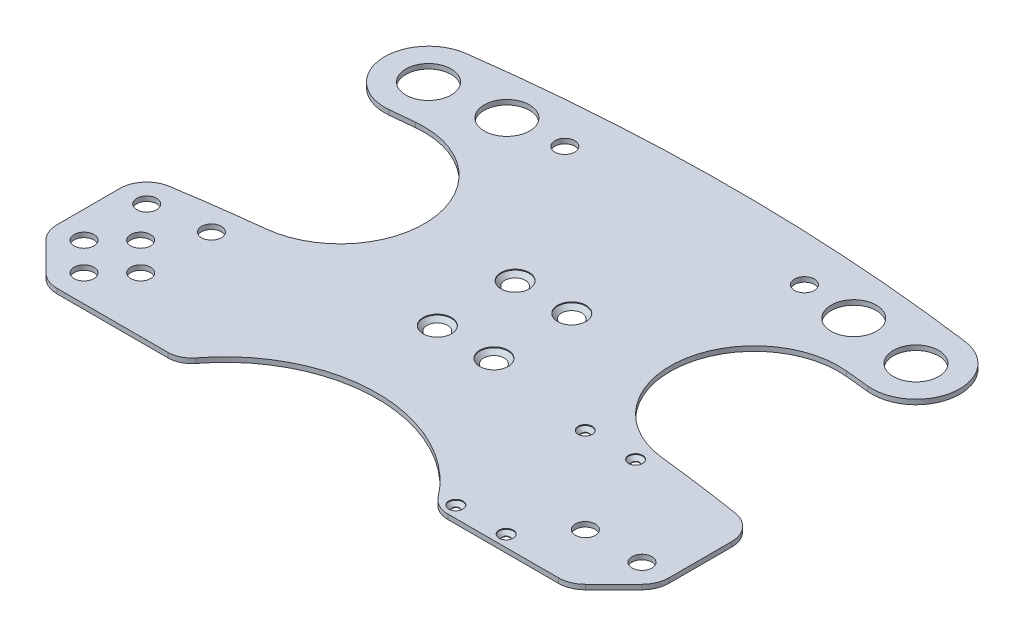
from build123d import *

# Parameters (mm, degrees)
SKETCH1_R                                      = 2.5
BOSS_EXTRUDE1_DEPTH                            = 1.7
CUT_EXTRUDE1_REACH                             = 155.062
SKETCH2_R                                      = 3.5
SKETCH2_R_2                                    = 8
CUT_EXTRUDE2_REACH                             = 155.062
SKETCH3_R                                      = 1.3
CSK_FOR_M5_FLAT_HEAD_MACHINE_SCREW1_AT_2_COUNT = 2
CSK_FOR_M5_FLAT_HEAD_MACHINE_SCREW1_AT_2_PITCH = 20
CSK_FOR_M5_FLAT_HEAD_MACHINE_SCREW1_AT_3_COUNT = 2
CSK_FOR_M5_FLAT_HEAD_MACHINE_SCREW1_AT_3_PITCH = 34.003676272
CSK_FOR_M5_FLAT_HEAD_MACHINE_SCREW1_AT_4_COUNT = 2
CSK_FOR_M5_FLAT_HEAD_MACHINE_SCREW1_AT_4_PITCH = 27.5
CSK_FOR_M2_5_FLAT_HEAD_MACHINE_SCREW1_AT_COUNT = 2
CSK_FOR_M2_5_FLAT_HEAD_MACHINE_SCREW1_AT_PITCH = 17.78
CSK_FOR_M2_5_FLAT_HEAD_MACHINE_SCREW_2_COUNT   = 2
CSK_FOR_M2_5_FLAT_HEAD_MACHINE_SCREW_2_PITCH   = 49.055548106
CSK_FOR_M2_5_FLAT_HEAD_MACHINE_SCREW_3_COUNT   = 2
CSK_FOR_M2_5_FLAT_HEAD_MACHINE_SCREW_3_PITCH   = 45.72
FILLET1_R                                      = 8.5


with BuildPart() as part:
    # Sketch1 → Boss-Extrude1 (new body)
    with BuildSketch(Plane(origin=(0, 0, 0), x_dir=(1, 0, 0), z_dir=(0, 1, 0))):
        with BuildLine():
            ThreePointArc((-73.314391493, 95), (-120, 0), (-73.314391493, -95))
            Line((-73.314391493, -95), (73.314391493, -95))
            ThreePointArc((73.314391493, -95), (120, 0), (73.314391493, 95))
            Line((73.314391493, 95), (-73.314391493, 95))
        make_face()
        with Locations(Location((10, 13.75, 0), (0, 0, 270))):
            Circle(SKETCH1_R, mode=Mode.SUBTRACT)
        with Locations(Location((10, -13.75, 0), (0, 0, 270))):
            Circle(SKETCH1_R, mode=Mode.SUBTRACT)
        with Locations(Location((-10, -13.75, 0), (0, 0, 270))):
            Circle(SKETCH1_R, mode=Mode.SUBTRACT)
        with Locations(Location((-10, 13.75, 0), (0, 0, 270))):
            Circle(SKETCH1_R, mode=Mode.SUBTRACT)
    extrude(amount=BOSS_EXTRUDE1_DEPTH)

    # Sketch2 → Cut-Extrude1 (cut, up to next)
    with BuildSketch(Plane(origin=(0, 1.7, 0), x_dir=(1, 0, 0), z_dir=(0, 1, 0)), mode=Mode.PRIVATE) as cut_extrude1_sk1:
        with Locations(Location((-88.540600769, -40, 0), (0, 0, 270))):
            Circle(SKETCH2_R)
    cut_extrude1_tool1 = extrude(cut_extrude1_sk1.sketch, amount=-CUT_EXTRUDE1_REACH, mode=Mode.PRIVATE) & part.part
    # Sketch2 → Cut-Extrude1 (cut, up to next)
    with BuildSketch(Plane(origin=(0, 1.7, 0), x_dir=(1, 0, 0), z_dir=(0, 1, 0)), mode=Mode.PRIVATE) as cut_extrude1_sk2:
        with Locations(Location((-78.540600769, -50, 0), (0, 0, 270))):
            Circle(SKETCH2_R)
    cut_extrude1_tool2 = extrude(cut_extrude1_sk2.sketch, amount=-CUT_EXTRUDE1_REACH, mode=Mode.PRIVATE) & part.part
    # Sketch2 → Cut-Extrude1 (cut, up to next)
    with BuildSketch(Plane(origin=(0, 1.7, 0), x_dir=(1, 0, 0), z_dir=(0, 1, 0)), mode=Mode.PRIVATE) as cut_extrude1_sk3:
        with Locations(Location((-88.540600769, -60, 0), (0, 0, 270))):
            Circle(SKETCH2_R)
    cut_extrude1_tool3 = extrude(cut_extrude1_sk3.sketch, amount=-CUT_EXTRUDE1_REACH, mode=Mode.PRIVATE) & part.part
    # Sketch2 → Cut-Extrude1 (cut, up to next)
    with BuildSketch(Plane(origin=(0, 1.7, 0), x_dir=(1, 0, 0), z_dir=(0, 1, 0)), mode=Mode.PRIVATE) as cut_extrude1_sk4:
        with Locations(Location((-98.540600769, -50, 0), (0, 0, 270))):
            Circle(SKETCH2_R)
    cut_extrude1_tool4 = extrude(cut_extrude1_sk4.sketch, amount=-CUT_EXTRUDE1_REACH, mode=Mode.PRIVATE) & part.part
    # Sketch2 → Cut-Extrude1 (cut, up to next)
    with BuildSketch(Plane(origin=(0, 1.7, 0), x_dir=(1, 0, 0), z_dir=(0, 1, 0)), mode=Mode.PRIVATE) as cut_extrude1_sk5:
        with Locations(Location((78.540600769, -50, 0), (0, 0, 270))):
            Circle(SKETCH2_R)
    cut_extrude1_tool5 = extrude(cut_extrude1_sk5.sketch, amount=-CUT_EXTRUDE1_REACH, mode=Mode.PRIVATE) & part.part
    # Sketch2 → Cut-Extrude1 (cut, up to next)
    with BuildSketch(Plane(origin=(0, 1.7, 0), x_dir=(1, 0, 0), z_dir=(0, 1, 0)), mode=Mode.PRIVATE) as cut_extrude1_sk6:
        with Locations(Location((98.540600769, -50, 0), (0, 0, 270))):
            Circle(SKETCH2_R)
    cut_extrude1_tool6 = extrude(cut_extrude1_sk6.sketch, amount=-CUT_EXTRUDE1_REACH, mode=Mode.PRIVATE) & part.part
    # Sketch2 → Cut-Extrude1 (cut, up to next)
    with BuildSketch(Plane(origin=(0, 1.7, 0), x_dir=(1, 0, 0), z_dir=(0, 1, 0)), mode=Mode.PRIVATE) as cut_extrude1_sk7:
        with Locations(Location((-98.540600769, -27.862546721, 0), (0, 0, 270))):
            Circle(SKETCH2_R)
    cut_extrude1_tool7 = extrude(cut_extrude1_sk7.sketch, amount=-CUT_EXTRUDE1_REACH, mode=Mode.PRIVATE) & part.part
    # Sketch2 → Cut-Extrude1 (cut, up to next)
    with BuildSketch(Plane(origin=(0, 1.7, 0), x_dir=(1, 0, 0), z_dir=(0, 1, 0)), mode=Mode.PRIVATE) as cut_extrude1_sk8:
        with Locations(Location((-78.540600769, -25, 0), (0, 0, 270))):
            Circle(SKETCH2_R)
    cut_extrude1_tool8 = extrude(cut_extrude1_sk8.sketch, amount=-CUT_EXTRUDE1_REACH, mode=Mode.PRIVATE) & part.part
    # Sketch2 → Cut-Extrude1 (cut, up to next)
    with BuildSketch(Plane(origin=(0, 1.7, 0), x_dir=(1, 0, 0), z_dir=(0, 1, 0)), mode=Mode.PRIVATE) as cut_extrude1_sk9:
        with Locations(Location((-86.094520408, 59.228232759, 0), (0, 0, 270))):
            Circle(SKETCH2_R_2)
    cut_extrude1_tool9 = extrude(cut_extrude1_sk9.sketch, amount=-CUT_EXTRUDE1_REACH, mode=Mode.PRIVATE) & part.part
    # Sketch2 → Cut-Extrude1 (cut, up to next)
    with BuildSketch(Plane(origin=(0, 1.7, 0), x_dir=(1, 0, 0), z_dir=(0, 1, 0)), mode=Mode.PRIVATE) as cut_extrude1_sk10:
        with Locations(Location((-61.259580586, 62.084312054, 0), (0, 0, 270))):
            Circle(SKETCH2_R_2)
    cut_extrude1_tool10 = extrude(cut_extrude1_sk10.sketch, amount=-CUT_EXTRUDE1_REACH, mode=Mode.PRIVATE) & part.part
    # Sketch2 → Cut-Extrude1 (cut, up to next)
    with BuildSketch(Plane(origin=(0, 1.7, 0), x_dir=(1, 0, 0), z_dir=(0, 1, 0)), mode=Mode.PRIVATE) as cut_extrude1_sk11:
        with Locations(Location((61.259580586, 62.084312054, 0), (0, 0, 270))):
            Circle(SKETCH2_R_2)
    cut_extrude1_tool11 = extrude(cut_extrude1_sk11.sketch, amount=-CUT_EXTRUDE1_REACH, mode=Mode.PRIVATE) & part.part
    # Sketch2 → Cut-Extrude1 (cut, up to next)
    with BuildSketch(Plane(origin=(0, 1.7, 0), x_dir=(1, 0, 0), z_dir=(0, 1, 0)), mode=Mode.PRIVATE) as cut_extrude1_sk12:
        with Locations(Location((86.094520408, 59.228232759, 0), (0, 0, 270))):
            Circle(SKETCH2_R_2)
    cut_extrude1_tool12 = extrude(cut_extrude1_sk12.sketch, amount=-CUT_EXTRUDE1_REACH, mode=Mode.PRIVATE) & part.part
    # Sketch2 → Cut-Extrude1 (cut, up to next)
    with BuildSketch(Plane(origin=(0, 1.7, 0), x_dir=(1, 0, 0), z_dir=(0, 1, 0)), mode=Mode.PRIVATE) as cut_extrude1_sk13:
        with Locations(Location((-42.320942156, 63.610082158, 0), (0, 0, 270))):
            Circle(SKETCH2_R)
    cut_extrude1_tool13 = extrude(cut_extrude1_sk13.sketch, amount=-CUT_EXTRUDE1_REACH, mode=Mode.PRIVATE) & part.part
    # Sketch2 → Cut-Extrude1 (cut, up to next)
    with BuildSketch(Plane(origin=(0, 1.7, 0), x_dir=(1, 0, 0), z_dir=(0, 1, 0)), mode=Mode.PRIVATE) as cut_extrude1_sk14:
        with Locations(Location((42.320942156, 63.610082158, 0), (0, 0, 270))):
            Circle(SKETCH2_R)
    cut_extrude1_tool14 = extrude(cut_extrude1_sk14.sketch, amount=-CUT_EXTRUDE1_REACH, mode=Mode.PRIVATE) & part.part
    add(cut_extrude1_tool1.solids().sort_by_distance((-88.540601, 1.7, 40))[0], mode=Mode.SUBTRACT)
    add(cut_extrude1_tool2.solids().sort_by_distance((-78.540601, 1.7, 50))[0], mode=Mode.SUBTRACT)
    add(cut_extrude1_tool3.solids().sort_by_distance((-88.540601, 1.7, 60))[0], mode=Mode.SUBTRACT)
    add(cut_extrude1_tool4.solids().sort_by_distance((-98.540601, 1.7, 50))[0], mode=Mode.SUBTRACT)
    add(cut_extrude1_tool5.solids().sort_by_distance((78.540601, 1.7, 50))[0], mode=Mode.SUBTRACT)
    add(cut_extrude1_tool6.solids().sort_by_distance((98.540601, 1.7, 50))[0], mode=Mode.SUBTRACT)
    add(cut_extrude1_tool7.solids().sort_by_distance((-98.540601, 1.7, 27.862547))[0], mode=Mode.SUBTRACT)
    add(cut_extrude1_tool8.solids().sort_by_distance((-78.540601, 1.7, 25))[0], mode=Mode.SUBTRACT)
    add(cut_extrude1_tool9.solids().sort_by_distance((-86.09452, 1.7, -59.228233))[0], mode=Mode.SUBTRACT)
    add(cut_extrude1_tool10.solids().sort_by_distance((-61.259581, 1.7, -62.084312))[0], mode=Mode.SUBTRACT)
    add(cut_extrude1_tool11.solids().sort_by_distance((61.259581, 1.7, -62.084312))[0], mode=Mode.SUBTRACT)
    add(cut_extrude1_tool12.solids().sort_by_distance((86.09452, 1.7, -59.228233))[0], mode=Mode.SUBTRACT)
    add(cut_extrude1_tool13.solids().sort_by_distance((-42.320942, 1.7, -63.610082))[0], mode=Mode.SUBTRACT)
    add(cut_extrude1_tool14.solids().sort_by_distance((42.320942, 1.7, -63.610082))[0], mode=Mode.SUBTRACT)

    # Sketch3 → Cut-Extrude2 (cut, up to next)
    with BuildSketch(Plane(origin=(0, 1.7, 0), x_dir=(1, 0, 0), z_dir=(0, 1, 0)), mode=Mode.PRIVATE) as cut_extrude2_sk1:
        with BuildLine():
            Line((-76.105925997, 44.650651574), (-84.550645906, 43.805313077))
            ThreePointArc((-84.550645906, 43.805313077), (-99.436668425, 51.339184255), (-98.864520937, 68.01328179))
            ThreePointArc((-98.864520937, 68.01328179), (-119.734623718, 7.976207306), (-107.01241698, -54.298642821))
            ThreePointArc((-107.01241698, -54.298642821), (-107.779979915, -52.209948642), (-108.040600769, -50))
            Line((-108.040600769, -50), (-108.040600769, -27.862546721))
            ThreePointArc((-108.040600769, -27.862546721), (-105.768300058, -21.697292226), (-100.038419088, -18.48136661))
            ThreePointArc((-100.038419088, -18.48136661), (-84.982869082, -16.262381048), (-69.878431955, -14.405108328))
            ThreePointArc((-69.878431955, -14.405108328), (-43.620166463, 18.220082253), (-76.105925997, 44.650651574))
        make_face()
    cut_extrude2_tool1 = extrude(cut_extrude2_sk1.sketch, amount=-CUT_EXTRUDE2_REACH, mode=Mode.PRIVATE) & part.part
    # Sketch3 → Cut-Extrude2 (cut, up to next)
    with BuildSketch(Plane(origin=(0, 1.7, 0), x_dir=(1, 0, 0), z_dir=(0, 1, 0)), mode=Mode.PRIVATE) as cut_extrude2_sk2:
        with BuildLine():
            ThreePointArc((-98.864520937, 68.01328179), (-94.209951098, 72.433905203), (-88.163447862, 74.589532807))
            ThreePointArc((-88.163447862, 74.589532807), (1.3e-08, 80.5), (88.163447888, 74.589532804))
            ThreePointArc((88.163447888, 74.589532804), (94.209951109, 72.433905197), (98.864520937, 68.01328179))
            ThreePointArc((98.864520937, 68.01328179), (87.140491227, 82.501725974), (73.314391493, 95))
            Line((73.314391493, 95), (-73.314391493, 95))
            ThreePointArc((-73.314391493, 95), (-87.140491227, 82.501725974), (-98.864520937, 68.01328179))
        make_face()
    cut_extrude2_tool2 = extrude(cut_extrude2_sk2.sketch, amount=-CUT_EXTRUDE2_REACH, mode=Mode.PRIVATE) & part.part
    # Sketch3 → Cut-Extrude2 (cut, up to next)
    with BuildSketch(Plane(origin=(0, 1.7, 0), x_dir=(1, 0, 0), z_dir=(0, 1, 0)), mode=Mode.PRIVATE) as cut_extrude2_sk3:
        with BuildLine():
            ThreePointArc((-105.258115191, -56.717514421), (-106.230963324, -55.577483643), (-107.01241698, -54.298642821))
            ThreePointArc((-107.01241698, -54.298642821), (-92.431539977, -76.52718744), (-73.314391493, -95))
            Line((-73.314391493, -95), (73.314391493, -95))
            ThreePointArc((73.314391493, -95), (92.431539785, -76.527187671), (107.012416708, -54.298643357))
            ThreePointArc((107.012416708, -54.298643357), (106.230963147, -55.577483886), (105.258115191, -56.717514421))
            Line((105.258115191, -56.717514421), (95.258115191, -66.717514421))
            ThreePointArc((95.258115191, -66.717514421), (92.176093377, -68.776855559), (88.540600769, -69.5))
            Line((88.540600769, -69.5), (45.040600769, -69.5))
            ThreePointArc((45.040600769, -69.5), (0, -45), (-45.040600769, -69.5))
            Line((-45.040600769, -69.5), (-88.540600769, -69.5))
            ThreePointArc((-88.540600769, -69.5), (-92.176093377, -68.776855559), (-95.258115191, -66.717514421))
            Line((-95.258115191, -66.717514421), (-105.258115191, -56.717514421))
        make_face()
    cut_extrude2_tool3 = extrude(cut_extrude2_sk3.sketch, amount=-CUT_EXTRUDE2_REACH, mode=Mode.PRIVATE) & part.part
    # Sketch3 → Cut-Extrude2 (cut, up to next)
    with BuildSketch(Plane(origin=(0, 1.7, 0), x_dir=(1, 0, 0), z_dir=(0, 1, 0)), mode=Mode.PRIVATE) as cut_extrude2_sk4:
        with BuildLine():
            ThreePointArc((76.105925997, 44.650651574), (43.620166505, 18.220082647), (69.878431166, -14.405108241))
            ThreePointArc((69.878431166, -14.405108241), (84.982868127, -16.262380919), (100.038417968, -18.481366431))
            ThreePointArc((100.038417968, -18.481366431), (105.768299691, -21.697291795), (108.040600769, -27.862546721))
            Line((108.040600769, -27.862546721), (108.040600769, -50))
            ThreePointArc((108.040600769, -50), (107.779979845, -52.209948935), (107.012416708, -54.298643357))
            ThreePointArc((107.012416708, -54.298643357), (119.734623738, 7.976207006), (98.864520937, 68.01328179))
            ThreePointArc((98.864520937, 68.01328179), (99.436668425, 51.339184255), (84.550645906, 43.805313077))
            Line((84.550645906, 43.805313077), (76.105925997, 44.650651574))
        make_face()
    cut_extrude2_tool4 = extrude(cut_extrude2_sk4.sketch, amount=-CUT_EXTRUDE2_REACH, mode=Mode.PRIVATE) & part.part
    # Sketch3 → Cut-Extrude2 (cut, up to next)
    with BuildSketch(Plane(origin=(0, 1.7, 0), x_dir=(1, 0, 0), z_dir=(0, 1, 0)), mode=Mode.PRIVATE) as cut_extrude2_sk5:
        with Locations(Location((48.150600769, -19.64, 0), (0, 0, 270))):
            Circle(SKETCH3_R)
    cut_extrude2_tool5 = extrude(cut_extrude2_sk5.sketch, amount=-CUT_EXTRUDE2_REACH, mode=Mode.PRIVATE) & part.part
    # Sketch3 → Cut-Extrude2 (cut, up to next)
    with BuildSketch(Plane(origin=(0, 1.7, 0), x_dir=(1, 0, 0), z_dir=(0, 1, 0)), mode=Mode.PRIVATE) as cut_extrude2_sk6:
        with Locations(Location((65.930600769, -19.64, 0), (0, 0, 270))):
            Circle(SKETCH3_R)
    cut_extrude2_tool6 = extrude(cut_extrude2_sk6.sketch, amount=-CUT_EXTRUDE2_REACH, mode=Mode.PRIVATE) & part.part
    # Sketch3 → Cut-Extrude2 (cut, up to next)
    with BuildSketch(Plane(origin=(0, 1.7, 0), x_dir=(1, 0, 0), z_dir=(0, 1, 0)), mode=Mode.PRIVATE) as cut_extrude2_sk7:
        with Locations(Location((65.930600769, -65.36, 0), (0, 0, 270))):
            Circle(SKETCH3_R)
    cut_extrude2_tool7 = extrude(cut_extrude2_sk7.sketch, amount=-CUT_EXTRUDE2_REACH, mode=Mode.PRIVATE) & part.part
    # Sketch3 → Cut-Extrude2 (cut, up to next)
    with BuildSketch(Plane(origin=(0, 1.7, 0), x_dir=(1, 0, 0), z_dir=(0, 1, 0)), mode=Mode.PRIVATE) as cut_extrude2_sk8:
        with Locations(Location((48.150600769, -65.36, 0), (0, 0, 270))):
            Circle(SKETCH3_R)
    cut_extrude2_tool8 = extrude(cut_extrude2_sk8.sketch, amount=-CUT_EXTRUDE2_REACH, mode=Mode.PRIVATE) & part.part
    add(cut_extrude2_tool1.solids().sort_by_distance((-86.043963, 1.7, -12.513289))[0], mode=Mode.SUBTRACT)
    add(cut_extrude2_tool2.solids().sort_by_distance((0, 1.7, -86.177495))[0], mode=Mode.SUBTRACT)
    add(cut_extrude2_tool3.solids().sort_by_distance((0, 1.7, 75.736765))[0], mode=Mode.SUBTRACT)
    add(cut_extrude2_tool4.solids().sort_by_distance((86.043963, 1.7, -12.513289))[0], mode=Mode.SUBTRACT)
    add(cut_extrude2_tool5.solids().sort_by_distance((48.150601, 1.7, 19.64))[0], mode=Mode.SUBTRACT)
    add(cut_extrude2_tool6.solids().sort_by_distance((65.930601, 1.7, 19.64))[0], mode=Mode.SUBTRACT)
    add(cut_extrude2_tool7.solids().sort_by_distance((65.930601, 1.7, 65.36))[0], mode=Mode.SUBTRACT)
    add(cut_extrude2_tool8.solids().sort_by_distance((48.150601, 1.7, 65.36))[0], mode=Mode.SUBTRACT)

    # Sketch5 → CSK for M5 Flat Head Machine Screw1 (revolve, cut)
    with BuildSketch(Plane(origin=(-10, 1.7, -13.75), x_dir=(0, 0, 1), z_dir=(1, 0, 0))):
        Polygon((0, 0), (0, 6.502151548), (2.5, 5), (2.5, 2.8), (5, 0.3), (5, 0), align=None)
    csk_for_m5_flat_head_machine_screw1 = revolve(axis=Axis((-10, 8.05, -13.75), (0, -1, 0)), mode=Mode.SUBTRACT)

    # CSK for M5 Flat Head Machine Screw1 at 2: CSK for M5 Flat Head Machine Screw1 ×2
    with Locations(*[(i * CSK_FOR_M5_FLAT_HEAD_MACHINE_SCREW1_AT_2_PITCH, 0, 0) for i in range(1, CSK_FOR_M5_FLAT_HEAD_MACHINE_SCREW1_AT_2_COUNT)]):
        add(csk_for_m5_flat_head_machine_screw1, mode=Mode.SUBTRACT)

    # CSK for M5 Flat Head Machine Screw1 at 3: CSK for M5 Flat Head Machine Screw1 ×2
    with Locations(*[Vector(0.5881716976750462, 0, 0.8087360843031886) * (i * CSK_FOR_M5_FLAT_HEAD_MACHINE_SCREW1_AT_3_PITCH) for i in range(1, CSK_FOR_M5_FLAT_HEAD_MACHINE_SCREW1_AT_3_COUNT)]):
        add(csk_for_m5_flat_head_machine_screw1, mode=Mode.SUBTRACT)

    # CSK for M5 Flat Head Machine Screw1 at 4: CSK for M5 Flat Head Machine Screw1 ×2
    with Locations(*[(0, 0, i * CSK_FOR_M5_FLAT_HEAD_MACHINE_SCREW1_AT_4_PITCH) for i in range(1, CSK_FOR_M5_FLAT_HEAD_MACHINE_SCREW1_AT_4_COUNT)]):
        add(csk_for_m5_flat_head_machine_screw1, mode=Mode.SUBTRACT)

    # Sketch7 → CSK for M2.5 Flat Head Machine Screw1 (revolve, cut)
    with BuildSketch(Plane(origin=(48.150600769, 1.7, 19.64), x_dir=(0, 0, 1), z_dir=(1, 0, 0))):
        Polygon((0, 0), (0, 5.751075774), (1.25, 5), (1.25, 1.55), (2.5, 0.3), (2.5, 0), align=None)
    csk_for_m2_5_flat_head_machine_screw1 = revolve(axis=Axis((48.150600769, 8.05, 19.64), (0, -1, 0)), mode=Mode.SUBTRACT)

    # CSK for M2.5 Flat Head Machine Screw1 at: CSK for M2.5 Flat Head Machine Screw1 ×2
    with Locations(*[(i * CSK_FOR_M2_5_FLAT_HEAD_MACHINE_SCREW1_AT_PITCH, 0, 0) for i in range(1, CSK_FOR_M2_5_FLAT_HEAD_MACHINE_SCREW1_AT_COUNT)]):
        add(csk_for_m2_5_flat_head_machine_screw1, mode=Mode.SUBTRACT)

    # CSK for M2.5 Flat Head Machine Screw 2: CSK for M2.5 Flat Head Machine Screw1 ×2
    with Locations(*[Vector(0.3624462611549487, 0, 0.9320046715412958) * (i * CSK_FOR_M2_5_FLAT_HEAD_MACHINE_SCREW_2_PITCH) for i in range(1, CSK_FOR_M2_5_FLAT_HEAD_MACHINE_SCREW_2_COUNT)]):
        add(csk_for_m2_5_flat_head_machine_screw1, mode=Mode.SUBTRACT)

    # CSK for M2.5 Flat Head Machine Screw 3: CSK for M2.5 Flat Head Machine Screw1 ×2
    with Locations(*[(0, 0, i * CSK_FOR_M2_5_FLAT_HEAD_MACHINE_SCREW_3_PITCH) for i in range(1, CSK_FOR_M2_5_FLAT_HEAD_MACHINE_SCREW_3_COUNT)]):
        add(csk_for_m2_5_flat_head_machine_screw1, mode=Mode.SUBTRACT)

    # Fillet1
    fillet1_edges = [part.edges().sort_by_distance(p)[0] for p in [
        (-45.040600769, 0.85, 69.5),
        (45.040600769, 0.85, 69.5),
    ]]
    fillet(fillet1_edges, radius=FILLET1_R)


solid = part.part
